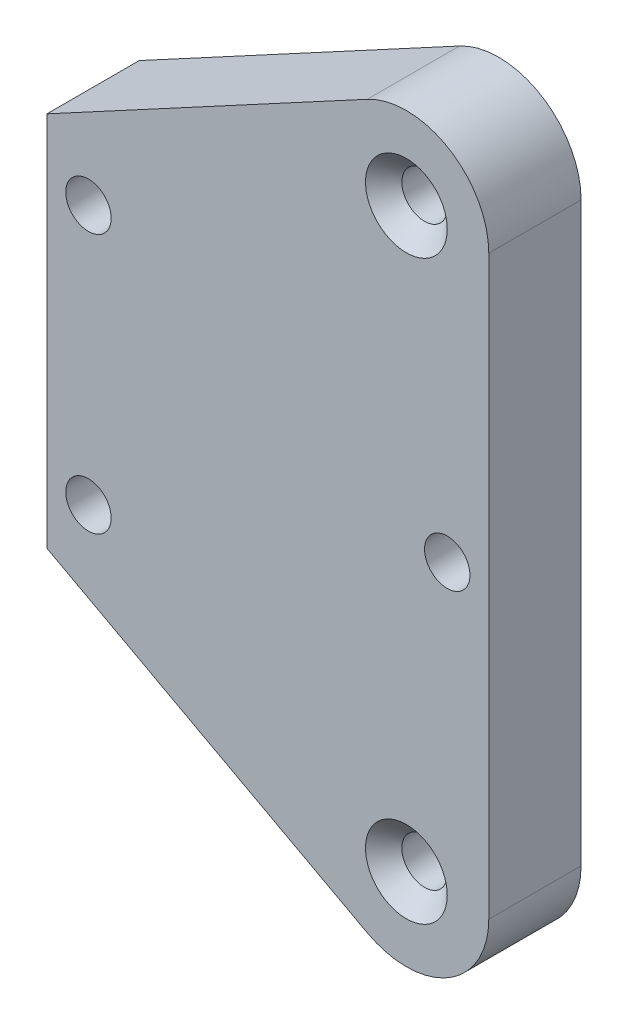
from build123d import *

# Parameters (mm, degrees)
SKETCH1_R                                       = 1.75
BOSS_EXTRUDE1_DEPTH                             = 7.112
CSK_FOR_M3_FLAT_HEAD_MACHINE_SCREW1_D           = 3.2
CSK_FOR_M3_FLAT_HEAD_MACHINE_SCREW1_CSINK_D     = 6.3
CSK_FOR_M3_FLAT_HEAD_MACHINE_SCREW1_CSINK_ANGLE = 90
CSK_FOR_M3_FLAT_HEAD_MACHINE_SCREW2_D           = 3.2
CSK_FOR_M3_FLAT_HEAD_MACHINE_SCREW2_CSINK_D     = 6.3
CSK_FOR_M3_FLAT_HEAD_MACHINE_SCREW2_CSINK_ANGLE = 90
CSK_FOR_M3_FLAT_HEAD_MACHINE_SCREW3_D           = 3.2
CSK_FOR_M3_FLAT_HEAD_MACHINE_SCREW3_CSINK_D     = 6.3
CSK_FOR_M3_FLAT_HEAD_MACHINE_SCREW3_CSINK_ANGLE = 90


with BuildPart() as part:
    # Sketch1 → Boss-Extrude1 (new body)
    with BuildSketch(Plane.XY):
        with BuildLine():
            Line((-27.7, 14.5), (-27.7, -14.5))
            Line((-27.7, -14.5), (-3.014335177, -27.813942963))
            ThreePointArc((-3.014335177, -27.813942963), (3.254341072, -27.677684127), (6.35, -22.225))
            Line((6.35, -22.225), (6.35, 22.225))
            ThreePointArc((6.35, 22.225), (3.254341072, 27.677684127), (-3.014335177, 27.813942963))
            Line((-3.014335177, 27.813942963), (-27.7, 14.5))
        make_face()
        with Locations((0, 22.225)):
            Circle(SKETCH1_R, mode=Mode.SUBTRACT)
        with Locations((0, -22.225)):
            Circle(SKETCH1_R, mode=Mode.SUBTRACT)
        with Locations((-24.5, 10)):
            Circle(SKETCH1_R, mode=Mode.SUBTRACT)
        with Locations((-24.5, -10)):
            Circle(SKETCH1_R, mode=Mode.SUBTRACT)
        with Locations((3.15, 0)):
            Circle(SKETCH1_R, mode=Mode.SUBTRACT)
    extrude(amount=BOSS_EXTRUDE1_DEPTH)

    # CSK for M3 Flat Head Machine Screw1 (through all)
    with Locations(Plane(origin=(-24.5, 10, 0), x_dir=(-1, 0, 0), z_dir=(0, 0, -1))):
        with Locations((0, 0), (0, -20)):
            CounterSinkHole(CSK_FOR_M3_FLAT_HEAD_MACHINE_SCREW1_D / 2, CSK_FOR_M3_FLAT_HEAD_MACHINE_SCREW1_CSINK_D / 2, counter_sink_angle=CSK_FOR_M3_FLAT_HEAD_MACHINE_SCREW1_CSINK_ANGLE)

    # CSK for M3 Flat Head Machine Screw2 (through all)
    with Locations(Plane(origin=(0, 0, 0), x_dir=(-1, 0, 0), z_dir=(0, 0, -1))):
        with Locations((-3.15, 0)):
            CounterSinkHole(CSK_FOR_M3_FLAT_HEAD_MACHINE_SCREW2_D / 2, CSK_FOR_M3_FLAT_HEAD_MACHINE_SCREW2_CSINK_D / 2, counter_sink_angle=CSK_FOR_M3_FLAT_HEAD_MACHINE_SCREW2_CSINK_ANGLE)

    # CSK for M3 Flat Head Machine Screw3 (through all)
    with Locations(Plane.XY.offset(7.112)):
        with Locations((0, 22.225), (0, -22.225)):
            CounterSinkHole(CSK_FOR_M3_FLAT_HEAD_MACHINE_SCREW3_D / 2, CSK_FOR_M3_FLAT_HEAD_MACHINE_SCREW3_CSINK_D / 2, counter_sink_angle=CSK_FOR_M3_FLAT_HEAD_MACHINE_SCREW3_CSINK_ANGLE)


solid = part.part
